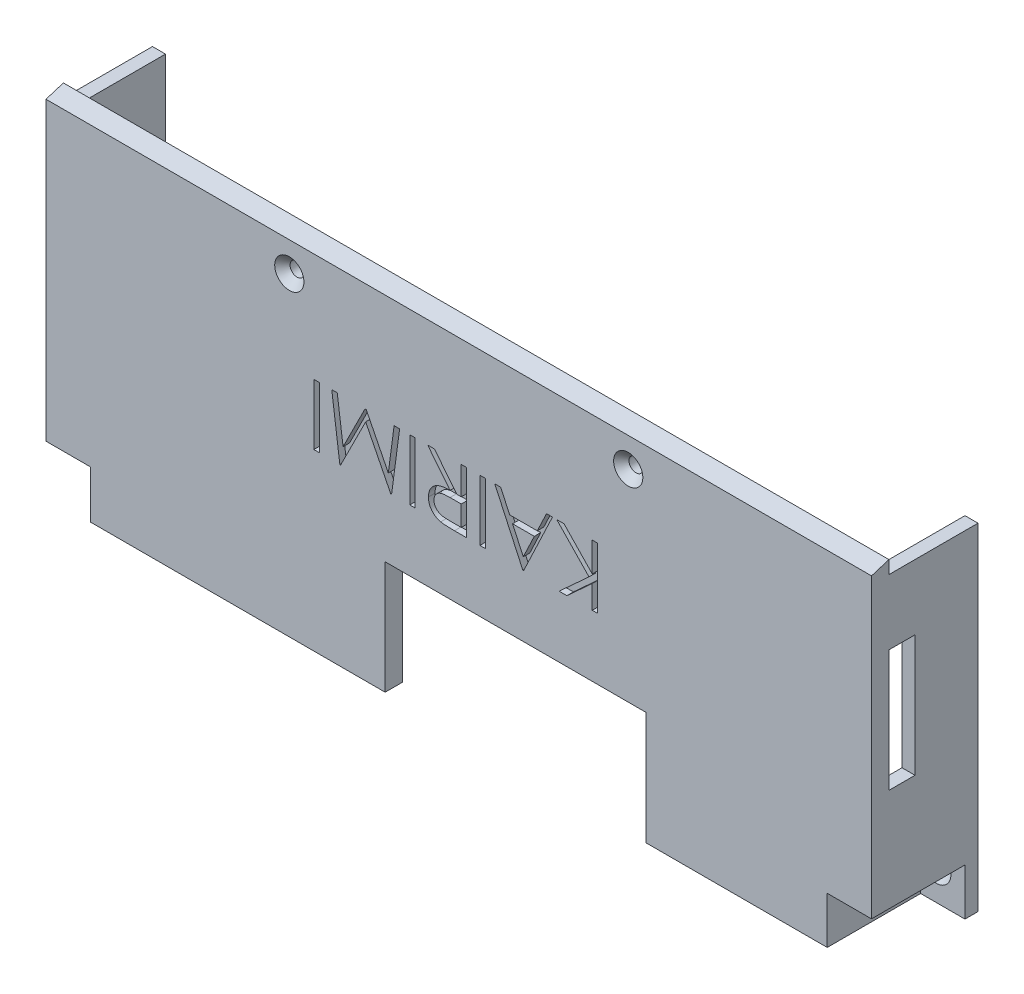
from build123d import *

# Parameters (mm, degrees)
CROQUIS1_R                      = 1.625
SALIENTE_EXTRUIR1_DEPTH         = 4
CORTAR_EXTRUIR1_START           = -190
CORTAR_EXTRUIR1_DEPTH           = 190
CROQUIS4_R                      = 3.35997123
CORTAR_EXTRUIR2_DEPTH           = 1.8
CORTAR_EXTRUIR2_DRAFT           = -44
CORTAR_EXTRUIR2_PROFILE_2_DEPTH = 1.8
CORTAR_EXTRUIR2_PROFILE_2_DRAFT = -44
CORTAR_EXTRUIR2_PROFILE_3_DEPTH = 1.8
CORTAR_EXTRUIR2_PROFILE_3_DRAFT = -44
CORTAR_EXTRUIR2_PROFILE_4_DEPTH = 1.8
CORTAR_EXTRUIR2_PROFILE_4_DRAFT = -44
CROQUIS5_W                      = 3
CROQUIS5_H                      = 66.6193621
CROQUIS5_H_2                    = 66.4193621
SALIENTE_EXTRUIR2_DEPTH         = 20.5
CROQUIS7_W                      = 10.2
CROQUIS7_H                      = 10.8
CROQUIS7_H_2                    = 11
CORTAR_EXTRUIR3_DEPTH           = 4
SALIENTE_EXTRUIR3_DEPTH         = 20.5
CROQUIS9_W                      = 10.2
CROQUIS9_H                      = 10.8
CROQUIS9_R                      = 1.625
CROQUIS9_H_2                    = 11
SALIENTE_EXTRUIR4_DEPTH         = 3
CROQUIS10_R                     = 3.35997123
CORTAR_EXTRUIR4_DEPTH           = 1.8
CORTAR_EXTRUIR4_DRAFT           = -44
CORTAR_EXTRUIR4_PROFILE_2_DEPTH = 1.8
CORTAR_EXTRUIR4_PROFILE_2_DRAFT = -44
CROQUIS11_W                     = 6
CROQUIS11_H                     = 28
CORTAR_EXTRUIR5_DEPTH           = 3
CROQUIS13_W                     = 1.256410257
CROQUIS13_H                     = 14
CROQUIS13_W_2                   = 1.256410256
CORTAR_EXTRUIR6_DEPTH           = 1.5


with BuildPart() as part:
    # Croquis1 → Saliente-Extruir1 (new body)
    with BuildSketch(Plane.XY):
        Polygon((-32.320991683, -51.284123552), (-32.320991683, 29.135238548), (157.679008317, 29.135238548), (157.679008317, -51.284123552), (105.737585684, -51.284123552), (105.737585684, -25.284123552), (45.737585684, -25.284123552), (45.737585684, -51.284123552), align=None)
        with Locations((23.679008317, 21.135238548)):
            Circle(CROQUIS1_R, mode=Mode.SUBTRACT)
        with Locations((101.679008317, 21.135238548)):
            Circle(CROQUIS1_R, mode=Mode.SUBTRACT)
        with Locations((-25.720991683, -43.884123552)):
            Circle(CROQUIS1_R, mode=Mode.SUBTRACT)
        with Locations((151.079008317, -44.084123552)):
            Circle(CROQUIS1_R, mode=Mode.SUBTRACT)
    extrude(amount=SALIENTE_EXTRUIR1_DEPTH)

    # Croquis3 → Cortar-Extruir1 (cut)
    with BuildSketch(Plane(origin=(157.679008317, 0, 0), x_dir=(0, 0, -1), z_dir=(1, 0, 0)).offset(CORTAR_EXTRUIR1_START)):
        Polygon((-4, 29.135238548), (0, 29.135238548), (-4, 27.880003721), align=None)
    extrude(amount=CORTAR_EXTRUIR1_DEPTH, mode=Mode.SUBTRACT)


with BuildPart() as cortar_extruir2_tool:
    # Croquis4 → Cortar-Extruir2 (with draft: the straight prism first)
    with BuildSketch(Plane.XY.offset(4)):
        with Locations((23.679008317, 21.135238548)):
            Circle(CROQUIS4_R)
    extrude(amount=-CORTAR_EXTRUIR2_DEPTH)
    # Cortar-Extruir2: the draft: its side faces are tilted about the plane it starts from
    cortar_extruir2_sides = [cortar_extruir2_tool.faces().sort_by_distance(p)[0] for p in [
        (20.319037087, 21.135238548, 3.1),
    ]]
    draft(cortar_extruir2_sides, Plane.XY.offset(4), CORTAR_EXTRUIR2_DRAFT)


with BuildPart() as part_1:
    add(part.part)

    # Cortar-Extruir2: cut by cortar_extruir2_tool
    add(cortar_extruir2_tool.part, mode=Mode.SUBTRACT)


with BuildPart() as cortar_extruir2_profile_2_tool:
    # Croquis4 → Cortar-Extruir2 profile 2 (with draft: the straight prism first)
    with BuildSketch(Plane.XY.offset(4)):
        with Locations((101.679008317, 21.135238548)):
            Circle(CROQUIS4_R)
    extrude(amount=-CORTAR_EXTRUIR2_PROFILE_2_DEPTH)
    # Cortar-Extruir2 profile 2: the draft: its side faces are tilted about the plane it starts from
    cortar_extruir2_profile_2_sides = [cortar_extruir2_profile_2_tool.faces().sort_by_distance(p)[0] for p in [
        (98.319037087, 21.135238548, 3.1),
    ]]
    draft(cortar_extruir2_profile_2_sides, Plane.XY.offset(4), CORTAR_EXTRUIR2_PROFILE_2_DRAFT)


with BuildPart() as part_2:
    add(part_1.part)

    # Cortar-Extruir2 profile 2: cut by cortar_extruir2_profile_2_tool
    add(cortar_extruir2_profile_2_tool.part, mode=Mode.SUBTRACT)


with BuildPart() as cortar_extruir2_profile_3_tool:
    # Croquis4 → Cortar-Extruir2 profile 3 (with draft: the straight prism first)
    with BuildSketch(Plane.XY.offset(4)):
        with Locations((-25.720991683, -43.884123552)):
            Circle(CROQUIS4_R)
    extrude(amount=-CORTAR_EXTRUIR2_PROFILE_3_DEPTH)
    # Cortar-Extruir2 profile 3: the draft: its side faces are tilted about the plane it starts from
    cortar_extruir2_profile_3_sides = [cortar_extruir2_profile_3_tool.faces().sort_by_distance(p)[0] for p in [
        (-29.080962913, -43.884123552, 3.1),
    ]]
    draft(cortar_extruir2_profile_3_sides, Plane.XY.offset(4), CORTAR_EXTRUIR2_PROFILE_3_DRAFT)


with BuildPart() as part_3:
    add(part_2.part)

    # Cortar-Extruir2 profile 3: cut by cortar_extruir2_profile_3_tool
    add(cortar_extruir2_profile_3_tool.part, mode=Mode.SUBTRACT)


with BuildPart() as cortar_extruir2_profile_4_tool:
    # Croquis4 → Cortar-Extruir2 profile 4 (with draft: the straight prism first)
    with BuildSketch(Plane.XY.offset(4)):
        with Locations((151.079008317, -44.084123552)):
            Circle(CROQUIS4_R)
    extrude(amount=-CORTAR_EXTRUIR2_PROFILE_4_DEPTH)
    # Cortar-Extruir2 profile 4: the draft: its side faces are tilted about the plane it starts from
    cortar_extruir2_profile_4_sides = [cortar_extruir2_profile_4_tool.faces().sort_by_distance(p)[0] for p in [
        (147.719037087, -44.084123552, 3.1),
    ]]
    draft(cortar_extruir2_profile_4_sides, Plane.XY.offset(4), CORTAR_EXTRUIR2_PROFILE_4_DRAFT)


with BuildPart() as part_4:
    add(part_3.part)

    # Cortar-Extruir2 profile 4: cut by cortar_extruir2_profile_4_tool
    add(cortar_extruir2_profile_4_tool.part, mode=Mode.SUBTRACT)

    # Croquis5 → Saliente-Extruir2 (add)
    with BuildSketch(Plane(origin=(0, 0, 0), x_dir=(-1, 0, 0), z_dir=(0, 0, -1))):
        with Locations((-156.179008317, -7.174442502)):
            Rectangle(CROQUIS5_W, CROQUIS5_H)
        with Locations((30.820991683, -7.074442502)):
            Rectangle(CROQUIS5_W, CROQUIS5_H_2)
    extrude(amount=SALIENTE_EXTRUIR2_DEPTH)

    # Croquis7 → Cortar-Extruir3 (cut)
    with BuildSketch(Plane(origin=(0, 0, 0), x_dir=(-1, 0, 0), z_dir=(0, 0, -1))):
        with Locations((-152.579008317, -45.884123552)):
            Rectangle(CROQUIS7_W, CROQUIS7_H)
        with Locations((27.220991683, -45.784123552)):
            Rectangle(CROQUIS7_W, CROQUIS7_H_2)
    extrude(amount=-CORTAR_EXTRUIR3_DEPTH, mode=Mode.SUBTRACT)

    # Croquis8 → Saliente-Extruir3 (add)
    with BuildSketch(Plane(origin=(0, 0, 0), x_dir=(-1, 0, 0), z_dir=(0, 0, -1))):
        Polygon((7.320991683, -47.484123552), (19.120991683, -47.484123552), (19.120991683, -40.284123552), (19.120991683, -37.284123552), (22.120991683, -37.284123552), (29.320991683, -37.284123552), (29.320991683, -40.284123552), (22.120991683, -40.284123552), (22.120991683, -47.484123552), (22.120991683, -51.284123552), (7.320991683, -51.284123552), align=None)
        Polygon((-132.679008317, -47.684123552), (-144.479008317, -47.684123552), (-144.479008317, -40.484123552), (-144.479008317, -37.284123552), (-154.679008317, -37.284123552), (-154.679008317, -40.484123552), (-147.479008317, -40.484123552), (-147.479008317, -47.684123552), (-147.479008317, -51.284123552), (-132.679008317, -51.284123552), align=None)
    extrude(amount=SALIENTE_EXTRUIR3_DEPTH)

    # Croquis9 → Saliente-Extruir4 (add)
    # profile 1 of 2: a face of its own
    with BuildSketch(Plane(origin=(0, 0, -20.5), x_dir=(-1, 0, 0), z_dir=(0, 0, -1))):
        with Locations((-152.579008317, -45.884123552)):
            Rectangle(CROQUIS9_W, CROQUIS9_H)
        with Locations((-151.079008317, -44.084123552)):
            Circle(CROQUIS9_R, mode=Mode.SUBTRACT)
    # profile 2 of 2: a face of its own
    with BuildSketch(Plane(origin=(0, 0, -20.5), x_dir=(-1, 0, 0), z_dir=(0, 0, -1))):
        with Locations((27.220991683, -45.784123552)):
            Rectangle(CROQUIS9_W, CROQUIS9_H_2)
        with Locations((25.720991683, -43.884123552)):
            Circle(CROQUIS9_R, mode=Mode.SUBTRACT)
    extrude(amount=-SALIENTE_EXTRUIR4_DEPTH)


with BuildPart() as cortar_extruir4_tool:
    # Croquis10 → Cortar-Extruir4 (with draft: the straight prism first)
    with BuildSketch(Plane.XY.offset(-17.5)):
        with Locations((-25.720991683, -43.884123552)):
            Circle(CROQUIS10_R)
    extrude(amount=-CORTAR_EXTRUIR4_DEPTH)
    # Cortar-Extruir4: the draft: its side faces are tilted about the plane it starts from
    cortar_extruir4_sides = [cortar_extruir4_tool.faces().sort_by_distance(p)[0] for p in [
        (-29.080962913, -43.884123552, -18.4),
    ]]
    draft(cortar_extruir4_sides, Plane.XY.offset(-17.5), CORTAR_EXTRUIR4_DRAFT)


with BuildPart() as part_5:
    add(part_4.part)

    # Cortar-Extruir4: cut by cortar_extruir4_tool
    add(cortar_extruir4_tool.part, mode=Mode.SUBTRACT)


with BuildPart() as cortar_extruir4_profile_2_tool:
    # Croquis10 → Cortar-Extruir4 profile 2 (with draft: the straight prism first)
    with BuildSketch(Plane.XY.offset(-17.5)):
        with Locations((151.079008317, -44.084123552)):
            Circle(CROQUIS10_R)
    extrude(amount=-CORTAR_EXTRUIR4_PROFILE_2_DEPTH)
    # Cortar-Extruir4 profile 2: the draft: its side faces are tilted about the plane it starts from
    cortar_extruir4_profile_2_sides = [cortar_extruir4_profile_2_tool.faces().sort_by_distance(p)[0] for p in [
        (147.719037087, -44.084123552, -18.4),
    ]]
    draft(cortar_extruir4_profile_2_sides, Plane.XY.offset(-17.5), CORTAR_EXTRUIR4_PROFILE_2_DRAFT)


with BuildPart() as part_6:
    add(part_5.part)

    # Cortar-Extruir4 profile 2: cut by cortar_extruir4_profile_2_tool
    add(cortar_extruir4_profile_2_tool.part, mode=Mode.SUBTRACT)

    # Croquis11 → Cortar-Extruir5 (cut)
    with BuildSketch(Plane(origin=(157.679008317, 0, 0), x_dir=(0, 0, -1), z_dir=(1, 0, 0))):
        with Locations((3, -2.864761452)):
            Rectangle(CROQUIS11_W, CROQUIS11_H)
    extrude(amount=-CORTAR_EXTRUIR5_DEPTH, mode=Mode.SUBTRACT)

    # Croquis13 → Cortar-Extruir6 (cut)
    # profile 1 of 7: a face of its own
    with BuildSketch(Plane.XY.offset(4)):
        with Locations((29.948239087, -4.119996279)):
            Rectangle(CROQUIS13_W, CROQUIS13_H)
    # profile 2 of 7: a face of its own
    with BuildSketch(Plane.XY.offset(4)):
        Polygon((49.063623702, 2.880003721), (47.215466651, -11.119996279), (47.035979471, -11.119996279), (41.255931394, 0.367183208), (35.489905753, -11.119996279), (35.307614086, -11.119996279), (33.448239086, 2.880003721), (34.710258317, 2.880003721), (36.050803189, -7.193714227), (41.104489086, 2.880003721), (41.387742292, 2.880003721), (46.461059599, -7.216150125), (47.798799984, 2.880003721), align=None)
    # profile 3 of 7: a face of its own
    with BuildSketch(Plane.XY.offset(4)):
        with Locations((52.025162163, -4.119996279)):
            Rectangle(CROQUIS13_W, CROQUIS13_H)
    # profile 4 of 7: a face of its own
    with BuildSketch(Plane.XY.offset(4)):
        with BuildLine():
            Line((64.499521138, -11.119996279), (61.697838445, -11.119996279))
            add(Edge.make_bspline(
                [(61.697838445, -11.119996279), (61.510873931, -11.119373935), (61.151881354, -11.118178965), (60.637588272, -11.111515914), (60.170279884, -11.092418491), (59.750200527, -11.075984157), (59.377357907, -11.046016392), (59.050608744, -11.017373803), (58.771457954, -10.97987916), (58.602474549, -10.945057468), (58.525963445, -10.929291151)],
                knots=[0, 0, 0, 0, 1.410062039, 2.707475311, 3.878576406, 4.937260626, 5.877586885, 6.699081471, 7.410979367, 8, 8, 8, 8], degree=3))
            add(Edge.make_bspline(
                [(58.525963445, -10.929291151), (58.423535224, -10.903986891), (58.220863854, -10.853918181), (57.92908861, -10.748039124), (57.650939007, -10.625710612), (57.387433636, -10.48093382), (57.138641547, -10.316153486), (56.904587805, -10.130707187), (56.688410611, -9.923006028), (56.482418712, -9.701653806), (56.302548437, -9.457013121), (56.140617473, -9.201498836), (56.004681977, -8.930191666), (55.897715912, -8.644460022), (55.808043127, -8.347106788), (55.747774644, -8.035193709), (55.710238379, -7.709735592), (55.706529794, -7.488290447), (55.704649343, -7.376005894)],
                knots=[0, 0, 0, 0, 1.027276577, 2.032638556, 3.019345632, 3.985365262, 4.957888996, 5.923693931, 6.890056973, 7.876427719, 8.865527834, 9.843495157, 10.821038291, 11.815616373, 12.812734995, 13.843357168, 14.906466538, 16, 16, 16, 16], degree=3))
            add(Edge.make_bspline(
                [(55.704649343, -7.376005894), (55.710525183, -7.189465261), (55.721990468, -6.825476171), (55.828893013, -6.297235643), (56.003991303, -5.80446742), (56.245313156, -5.347857264), (56.552484852, -4.936065183), (56.92163538, -4.575598095), (57.350879516, -4.271167216), (57.752353734, -4.062300802), (58.10716327, -3.927907198), (58.40012195, -3.832872669), (58.719933006, -3.760684762), (59.062008263, -3.695076041), (59.428989945, -3.645011316), (59.82013904, -3.609455846), (60.236433836, -3.586593409), (60.521792882, -3.583253109), (60.668591651, -3.58153474)],
                knots=[0, 0, 0, 0, 1.260402266, 2.459371274, 3.627181936, 4.786749125, 5.93865593, 7.087644312, 8.261344208, 9.485713728, 10.136162886, 10.825977872, 11.566646758, 12.35154167, 13.181268117, 14.0701832, 15.007234106, 16, 16, 16, 16], degree=3))
            Line((60.668591651, -3.58153474), (55.525162163, 2.880003721))
            Line((55.525162163, 2.880003721), (57.078848061, 2.880003721))
            Line((57.078848061, 2.880003721), (62.222277548, -3.58153474))
            Line((62.222277548, -3.58153474), (63.243110881, -3.58153474))
            Line((63.243110881, -3.58153474), (63.243110881, 2.880003721))
            Line((63.243110881, 2.880003721), (64.499521138, 2.880003721))
            Line((64.499521138, 2.880003721), (64.499521138, -11.119996279))
        make_face()
        with BuildLine():
            Line((63.243110881, -9.684098843), (63.243110881, -5.017432176))
            Line((63.243110881, -5.017432176), (60.679809599, -4.997800766))
            add(Edge.make_bspline(
                [(60.679809599, -4.997800766), (60.560129428, -4.997747789), (60.328155171, -4.997645104), (59.992552716, -5.013620621), (59.680071574, -5.031792493), (59.391910885, -5.059594549), (59.127928962, -5.095403481), (58.888300168, -5.140265497), (58.672494956, -5.192310561), (58.421604389, -5.273687036), (58.138223081, -5.397054236), (57.836601799, -5.588345801), (57.572842627, -5.819684755), (57.353555996, -6.08756285), (57.177424726, -6.383355629), (57.055085869, -6.700368862), (56.974465275, -7.033607695), (56.965579678, -7.262416159), (56.961059599, -7.378810381)],
                knots=[0, 0, 0, 0, 1.146399208, 2.222048177, 3.218135709, 4.144938032, 4.994811973, 5.769438708, 6.479732432, 7.119818093, 8.294689872, 9.430121864, 10.527913442, 11.641375077, 12.733452768, 13.811150417, 14.886538365, 16, 16, 16, 16], degree=3))
            add(Edge.make_bspline(
                [(56.961059599, -7.378810381), (56.965808546, -7.491418694), (56.975219226, -7.71456728), (57.053802215, -8.040515814), (57.182115791, -8.350450089), (57.357744144, -8.640105209), (57.576332464, -8.901088562), (57.830938626, -9.123707736), (58.115571182, -9.3086534), (58.379444082, -9.430680999), (58.617022621, -9.502482228), (58.822348787, -9.554602662), (59.056372543, -9.591105452), (59.31633946, -9.624678267), (59.603391554, -9.653109297), (59.917703754, -9.671980414), (60.259051323, -9.683259712), (60.495638983, -9.683812623), (60.618110881, -9.684098843)],
                knots=[0, 0, 0, 0, 1.100596872, 2.180981401, 3.259506136, 4.371595435, 5.481727359, 6.576991111, 7.667816242, 8.793363246, 9.406619729, 10.09427138, 10.864108636, 11.721733836, 12.6590937, 13.685439239, 14.801845161, 16, 16, 16, 16], degree=3))
            Line((60.618110881, -9.684098843), (63.243110881, -9.684098843))
        make_face(mode=Mode.SUBTRACT)
    # profile 5 of 7: a face of its own
    with BuildSketch(Plane.XY.offset(4)):
        with Locations((68.179008317, -4.119996279)):
            Rectangle(CROQUIS13_W_2, CROQUIS13_H)
    # profile 6 of 7: a face of its own
    with BuildSketch(Plane.XY.offset(4)):
        Polygon((77.422598061, -11.119996279), (70.961059599, 2.880003721), (72.326844856, 2.880003721), (74.396556394, -1.607175766), (80.743110881, -1.607175766), (82.871716651, 2.880003721), (84.243110881, 2.880003721), (77.60208524, -11.119996279), align=None)
        Polygon((77.526364086, -8.391230253), (80.061620497, -3.043073202), (75.058415368, -3.043073202), align=None, mode=Mode.SUBTRACT)
    # profile 7 of 7: a face of its own
    with BuildSketch(Plane.XY.offset(4)):
        Polygon((94.653367292, -11.119996279), (93.396957035, -11.119996279), (93.396957035, -5.788666151), (87.560819215, -11.119996279), (85.768751907, -11.119996279), (92.648158958, -4.837944997), (85.230290368, 2.880003721), (86.904569215, 2.880003721), (93.396957035, -3.876005894), (93.396957035, 2.880003721), (94.653367292, 2.880003721), align=None)
    extrude(amount=-CORTAR_EXTRUIR6_DEPTH, mode=Mode.SUBTRACT)


solid = part_6.part
